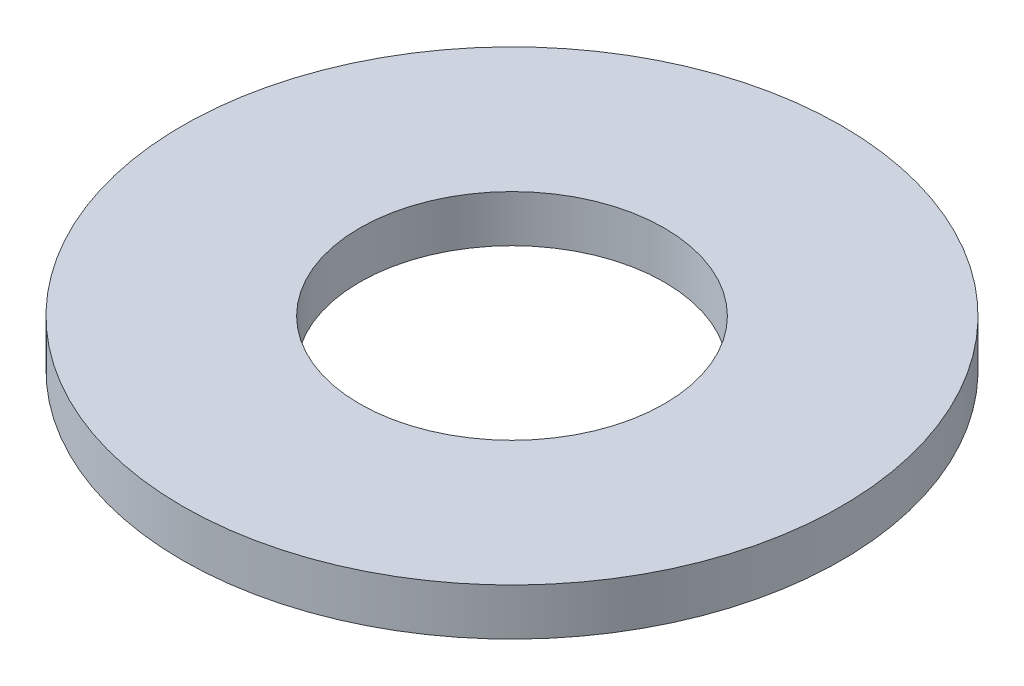
from build123d import *

# Parameters (mm, degrees)
SKETCH1_R           = 3.571875
SKETCH1_R_2         = 1.651
BOSS_EXTRUDE1_DEPTH = 0.254


with BuildPart() as part:
    # Sketch1 → Boss-Extrude1 (new, symmetric)
    with BuildSketch(Plane(origin=(0, 0, 0), x_dir=(1, 0, 0), z_dir=(0, 1, 0))):
        with Locations(Location((0, 0, 0), (0, 0, 270))):
            Circle(SKETCH1_R)
        with Locations(Location((0, 0, 0), (0, 0, 270))):
            Circle(SKETCH1_R_2, mode=Mode.SUBTRACT)
    extrude(amount=BOSS_EXTRUDE1_DEPTH, both=True)


solid = part.part
